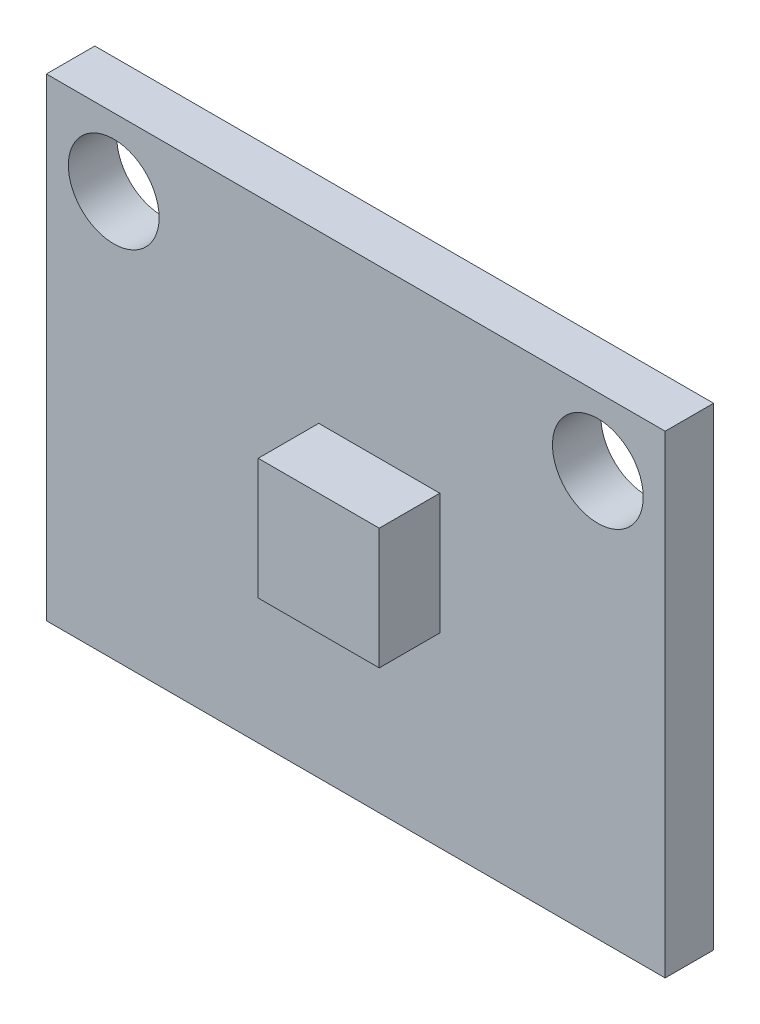
from build123d import *

# Parameters (mm, degrees)
SKICA1_W                = 20.45
SKICA1_H                = 15.65
SKICA1_R                = 1.5
P_IDAT_VYSUNUT_M1_DEPTH = 1.6
SKICA2_W                = 4
SKICA2_H                = 4
P_IDAT_VYSUNUT_M2_DEPTH = 2


with BuildPart() as part:
    # Skica1 → Přidat vysunutím1 (new body)
    with BuildSketch(Plane.XY):
        Rectangle(SKICA1_W, SKICA1_H)
        with Locations((-8, 5.575)):
            Circle(SKICA1_R, mode=Mode.SUBTRACT)
        with Locations((8, 5.575)):
            Circle(SKICA1_R, mode=Mode.SUBTRACT)
    extrude(amount=P_IDAT_VYSUNUT_M1_DEPTH)


with BuildPart() as body_2:
    # Skica2 → Přidat vysunutím2 (new body)
    with BuildSketch(Plane.XY.offset(1.6)):
        with Locations((0.775, 0.325)):
            Rectangle(SKICA2_W, SKICA2_H)
    extrude(amount=P_IDAT_VYSUNUT_M2_DEPTH)


solid = Compound([part.part, body_2.part])
